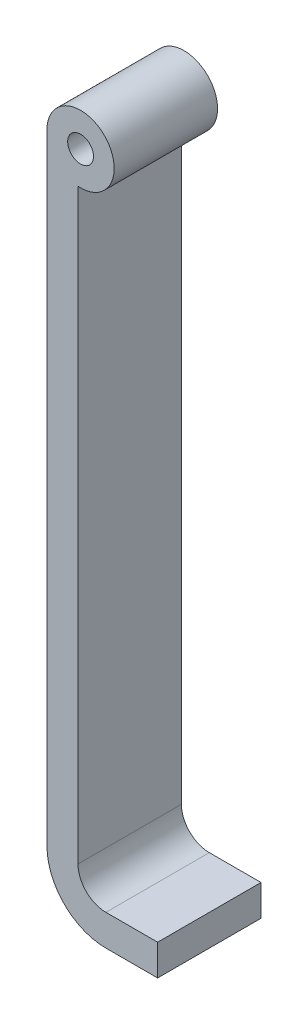
from build123d import *

# Parameters (mm, degrees)
SKETCH1_R           = 1.25
BOSS_EXTRUDE1_DEPTH = 10


with BuildPart() as part:
    # Sketch1 → Boss-Extrude1 (new body)
    with BuildSketch(Plane.XY):
        with BuildLine():
            Line((-3.25, 0), (-3.25, -60))
            ThreePointArc((-3.25, -60), (-1.580508653, -64.030508653), (2.45, -65.7))
            Line((2.45, -65.7), (7.45, -65.7))
            Line((7.45, -65.7), (7.45, -62.7))
            Line((7.45, -62.7), (2.45, -62.7))
            ThreePointArc((2.45, -62.7), (0.540811691, -61.909188309), (-0.25, -60))
            Line((-0.25, -60), (-0.25, -3.240370349))
            ThreePointArc((-0.25, -3.240370349), (2.384848004, 2.207940217), (-3.25, 0))
        make_face()
        Circle(SKETCH1_R, mode=Mode.SUBTRACT)
    extrude(amount=BOSS_EXTRUDE1_DEPTH)


solid = part.part
